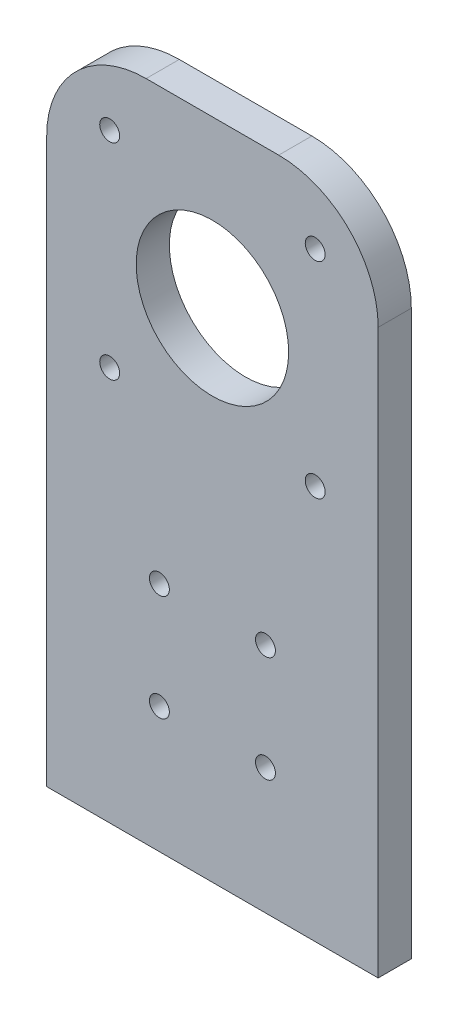
from build123d import *

# Parameters (mm, degrees)
SKETCH4_R           = 11.5
SKETCH4_R_2         = 1.5
BOSS_EXTRUDE1_DEPTH = 5
SKETCH5_R           = 1.5
CUT_EXTRUDE1_DEPTH  = 111.101739948


with BuildPart() as part:
    # Sketch4 → Boss-Extrude1 (new body)
    with BuildSketch(Plane.XY):
        with BuildLine():
            Line((-10.087403903, 107.088819702), (9.912596097, 107.088819702))
            ThreePointArc((9.912596097, 107.088819702), (20.519197815, 102.695421419), (24.912596097, 92.088819702))
            Line((24.912596097, 92.088819702), (24.912596097, 7.088819702))
            Line((24.912596097, 7.088819702), (-25.087403903, 7.088819702))
            Line((-25.087403903, 7.088819702), (-25.087403903, 92.088819702))
            ThreePointArc((-25.087403903, 92.088819702), (-20.694005621, 102.695421419), (-10.087403903, 107.088819702))
        make_face()
        with Locations((-0.087403903, 82.088819702)):
            Circle(SKETCH4_R, mode=Mode.SUBTRACT)
        with Locations((15.412596097, 66.588819702)):
            Circle(SKETCH4_R_2, mode=Mode.SUBTRACT)
        with Locations(Location((-15.587403903, 66.588819702, 0), (0, 0, 180))):
            Circle(SKETCH4_R_2, mode=Mode.SUBTRACT)
        with Locations(Location((15.412596097, 97.588819702, 0), (0, 0, 180))):
            Circle(SKETCH4_R_2, mode=Mode.SUBTRACT)
        with Locations((-15.587403903, 97.588819702)):
            Circle(SKETCH4_R_2, mode=Mode.SUBTRACT)
        with Locations((-8.087403903, 42.088819702)):
            Circle(SKETCH4_R_2, mode=Mode.SUBTRACT)
        with Locations(Location((7.912596097, 42.088819702, 0), (0, 0, 180))):
            Circle(SKETCH4_R_2, mode=Mode.SUBTRACT)
    extrude(amount=BOSS_EXTRUDE1_DEPTH)

    # Sketch5 → Cut-Extrude1 (cut, through all)
    with BuildSketch(Plane(origin=(0, 0, 0), x_dir=(-1, 0, 0), z_dir=(0, 0, -1))):
        with Locations((8.087403903, 26.088819702)):
            Circle(SKETCH5_R)
        with Locations((-7.912596097, 26.088819702)):
            Circle(SKETCH5_R)
    extrude(amount=-CUT_EXTRUDE1_DEPTH, mode=Mode.SUBTRACT)


solid = part.part
